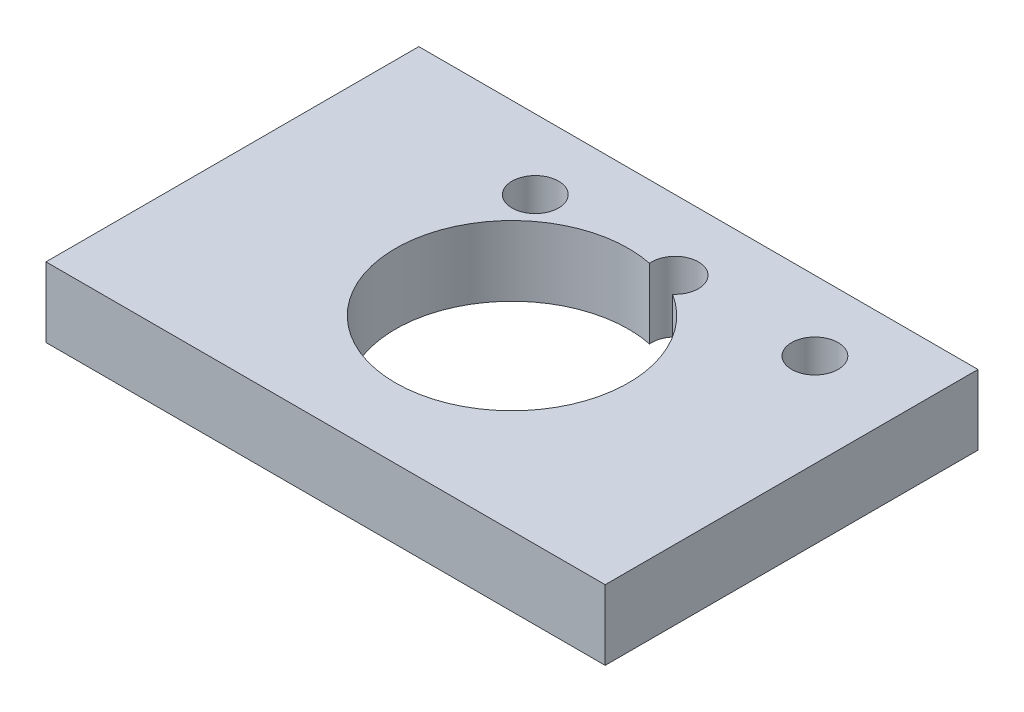
from build123d import *

# Parameters (mm, degrees)
SKETCH_1_W             = 120
SKETCH_1_H             = 80
EXTRUDE_1_DEPTH        = 15
SKETCH_2_R             = 25
CUT_EXTRUDE_1_DEPTH    = 15
SKETCH_3_R             = 5
CUT_EXTRUDE_2_DEPTH    = 15
PATTERN_LINEAR_1_COUNT = 3
PATTERN_LINEAR_1_PITCH = 30


with BuildPart() as part:
    # 草图1 → 凸台-拉伸1 (new body)
    with BuildSketch(Plane(origin=(0, 0, 0), x_dir=(1, 0, 0), z_dir=(0, 1, 0))):
        Rectangle(SKETCH_1_W, SKETCH_1_H)
    extrude(amount=EXTRUDE_1_DEPTH)

    # 草图2 → 切除-拉伸1 (cut)
    with BuildSketch(Plane(origin=(0, 0, 0), x_dir=(1, 0, 0), z_dir=(0, 1, 0))):
        with Locations(Location((0, 0, 0), (0, 0, 270))):
            Circle(SKETCH_2_R)
    extrude(amount=CUT_EXTRUDE_1_DEPTH, mode=Mode.SUBTRACT)

    # 草图3 → 切除-拉伸2 (cut)
    with BuildSketch(Plane(origin=(0, 0, 0), x_dir=(1, 0, 0), z_dir=(0, 1, 0))):
        with Locations(Location((40, 25, 0), (0, 0, 270))):
            Circle(SKETCH_3_R)
    cut_extrude_2 = extrude(amount=CUT_EXTRUDE_2_DEPTH, mode=Mode.SUBTRACT)

    # 阵列(线性)1: 切除-拉伸2 ×3
    with Locations(*[(-i * PATTERN_LINEAR_1_PITCH, 0, 0) for i in range(1, PATTERN_LINEAR_1_COUNT)]):
        add(cut_extrude_2, mode=Mode.SUBTRACT)


solid = part.part
